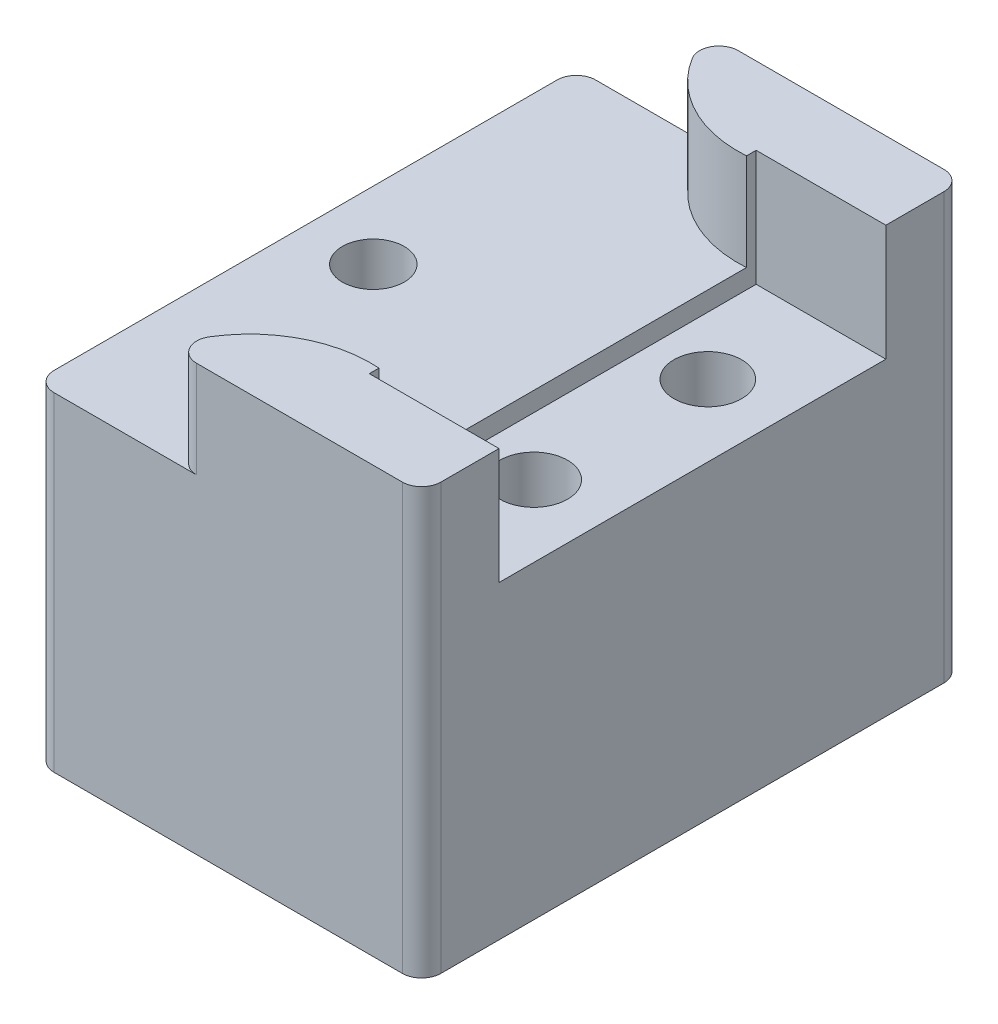
from build123d import *

# Parameters (mm, degrees)
CROQUIS2_W              = 20
CROQUIS2_H              = 28
SALIENTE_EXTRUIR1_DEPTH = 22
CROQUIS3_W              = 6.705751287
CROQUIS3_H              = 20
CORTAR_EXTRUIR1_DEPTH   = 6
CORTAR_EXTRUIR2_DEPTH   = 5
CROQUIS6_R              = 1.6
CORTAR_EXTRUIR3_DEPTH   = 23.678404419
REDONDEO1_R             = 1
SKETCH1_R               = 1.75
CUT_EXTRUDE1_DEPTH      = 28.474488211


with BuildPart() as part:
    # Croquis2 → Saliente-Extruir1 (new body)
    with BuildSketch(Plane(origin=(0, 0, 0), x_dir=(1, 0, 0), z_dir=(0, 1, 0))):
        with Locations((-0.843373494, -5.526104418)):
            Rectangle(CROQUIS2_W, CROQUIS2_H)
    extrude(amount=SALIENTE_EXTRUIR1_DEPTH)

    # Croquis3 → Cortar-Extruir1 (cut)
    with BuildSketch(Plane(origin=(0, 22, 0), x_dir=(1, 0, 0), z_dir=(0, 1, 0))):
        with Locations((5.803750863, -5.526104418)):
            Rectangle(CROQUIS3_W, CROQUIS3_H)
    extrude(amount=-CORTAR_EXTRUIR1_DEPTH, mode=Mode.SUBTRACT)

    # Croquis5 → Cortar-Extruir2 (cut)
    with BuildSketch(Plane(origin=(0, 22, 0), x_dir=(1, 0, 0), z_dir=(0, 1, 0))):
        with BuildLine():
            Line((2.450875219, -15.026104418), (2.450875219, 3.973895582))
            ThreePointArc((2.450875219, 3.973895582), (2.020425803, 3.959111389), (1.589976387, 3.973895582))
            ThreePointArc((1.589976387, 3.973895582), (-1.912953919, 5.345273007), (-4.00171373, 8.473895582))
            Line((-4.00171373, 8.473895582), (-10.843373494, 8.473895582))
            Line((-10.843373494, 8.473895582), (-10.843373494, -19.526104418))
            Line((-10.843373494, -19.526104418), (-4.00171373, -19.526104418))
            ThreePointArc((-4.00171373, -19.526104418), (-1.912953919, -16.397481842), (1.589976387, -15.026104418))
            ThreePointArc((1.589976387, -15.026104418), (2.020425803, -15.011320225), (2.450875219, -15.026104418))
        make_face()
    extrude(amount=-CORTAR_EXTRUIR2_DEPTH, mode=Mode.SUBTRACT)

    # Croquis6 → Cortar-Extruir3 (cut)
    with BuildSketch(Plane(origin=(0, 17, 0), x_dir=(1, 0, 0), z_dir=(0, 1, 0))):
        with Locations(Location((-7.343373494, -5.526104418, 0), (0, 0, 270))):
            Circle(CROQUIS6_R)
    extrude(amount=-CORTAR_EXTRUIR3_DEPTH, mode=Mode.SUBTRACT)

    # Redondeo1
    redondeo1_edges = [part.edges().sort_by_distance(p)[0] for p in [
        (-10.843373494, 8.5, -8.473895582),
        (-10.843373494, 8.5, 19.526104418),
        (-4.00171373, 19.5, 19.526104418),
        (-4.00171373, 19.5, -8.473895582),
        (9.156626506, 11, -8.473895582),
        (9.156626506, 11, 19.526104418),
    ]]
    fillet(redondeo1_edges, radius=REDONDEO1_R)

    # Sketch1 → Cut-Extrude1 (cut, through all)
    with BuildSketch(Plane(origin=(0, 16, 0), x_dir=(1, 0, 0), z_dir=(0, 1, 0))):
        with Locations(Location((5.450875219, -1.026104418, 0), (0, 0, 270))):
            Circle(SKETCH1_R)
        with Locations(Location((5.450875219, -10.026104418, 0), (0, 0, 270))):
            Circle(SKETCH1_R)
    extrude(amount=-CUT_EXTRUDE1_DEPTH, mode=Mode.SUBTRACT)


solid = part.part
